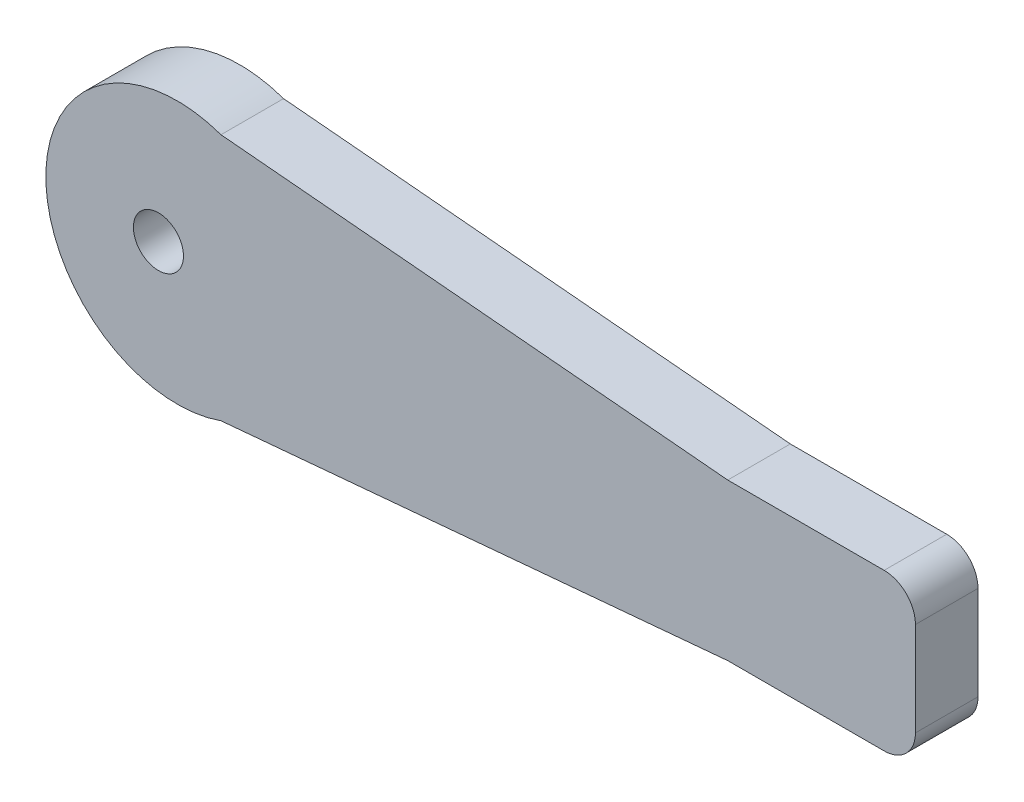
from build123d import *

# Parameters (mm, degrees)
SKETCH_1_W          = 30
SKETCH_1_H          = 25
EXTRUDE_1_DEPTH     = 10
FILLET_1_R          = 5
SKETCH_2_R          = 4
CUT_EXTRUDE_1_DEPTH = 14


with BuildPart() as part:
    # 草图1 → 凸台-拉伸1 (new body)
    with BuildSketch(Plane.XY):
        with BuildLine():
            ThreePointArc((-27.5, 0), (-31.353571801, 12.124355653), (-41.5, 19.798989873))
            ThreePointArc((-41.5, 19.798989873), (-44.948858447, 20.697569753), (-48.5, 21))
            ThreePointArc((-48.5, 21), (-63.349242405, 14.849242405), (-69.5, 0))
            ThreePointArc((-69.5, 0), (-63.349242405, -14.849242405), (-48.5, -21))
            ThreePointArc((-48.5, -21), (-44.948858447, -20.697569753), (-41.5, -19.798989873))
            ThreePointArc((-41.5, -19.798989873), (-31.353571801, -12.124355653), (-27.5, 0))
        make_face()
        with BuildLine():
            Line((39.5, 12.5), (-41.5, 19.798989873))
            ThreePointArc((-41.5, 19.798989873), (-31.353571801, 12.124355653), (-27.5, 0))
            ThreePointArc((-27.5, 0), (-31.353571801, -12.124355653), (-41.5, -19.798989873))
            Line((-41.5, -19.798989873), (39.5, -12.5))
            Line((39.5, -12.5), (39.5, 12.5))
        make_face()
        with Locations((54.5, 0)):
            Rectangle(SKETCH_1_W, SKETCH_1_H)
    extrude(amount=EXTRUDE_1_DEPTH)

    # 圆角1
    fillet_1_edges = [part.edges().sort_by_distance(p)[0] for p in [
        (69.5, 12.5, 5),
        (69.5, -12.5, 5),
    ]]
    fillet(fillet_1_edges, radius=FILLET_1_R)

    # 草图2 → 切除-拉伸1 (cut)
    with BuildSketch(Plane.XY.offset(10)):
        with Locations((-51.5, 0)):
            Circle(SKETCH_2_R)
    extrude(amount=-CUT_EXTRUDE_1_DEPTH, mode=Mode.SUBTRACT)


solid = part.part
